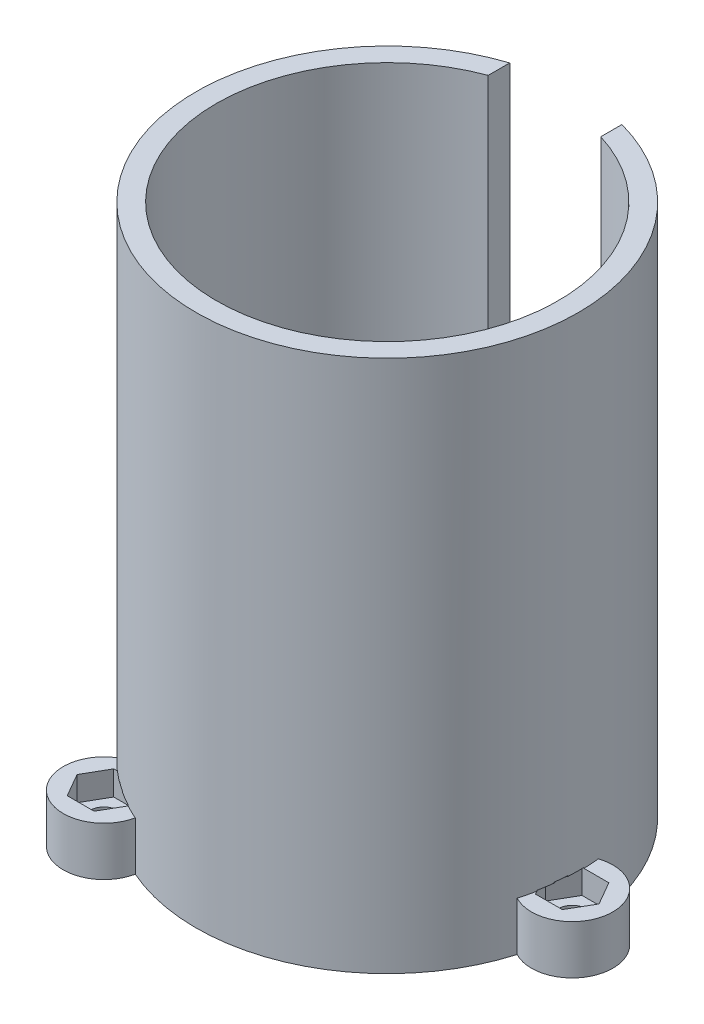
from build123d import *

# Parameters (mm, degrees)
WHEEL_SUPPORT_RAILS_1_PROFILE_R       = 1.7
WHEEL_SUPPORT_RAILS_1_EXTRUSION_DEPTH = 3
WHEEL_SUPPORT_RAILS_2_EXTRUSION_DEPTH = 3
WHEEL_SUPPORT_RAILS_3_EXTRUSION_DEPTH = 0.1
WHEEL_SUPPORT_RAILS_4_EXTRUSION_DEPTH = 0.1
PIVOT_BACKING_5_EXTRUSION_DEPTH       = 59.3


with BuildPart() as part:
    # Wheel support rails 1 profile → Wheel support rails 1 extrusion (new body)
    with BuildSketch(Plane(origin=(0, -200, 0), x_dir=(1, 0, 0), z_dir=(0, 1, 0))):
        with BuildLine():
            Line((-19.3635199, 72.551817663), (-19.796031534, 72.551817663))
            Line((-19.796031534, 72.551817663), (-19.796031534, 77.344882879))
            Line((-19.796031534, 77.344882879), (-18.287181296, 77.344882879))
            ThreePointArc((-18.287181296, 77.344882879), (-19.831302101, 79.707937327), (-22.409182889, 80.858096458))
            Line((-22.409182889, 80.858096458), (-22.409182889, 77.466920099))
            ThreePointArc((-22.409182889, 77.466920099), (-21.643496924, 74.985063993), (-24.218406931, 74.644882879))
            Line((-24.218406931, 74.644882879), (-27.913875328, 74.644882879))
            ThreePointArc((-27.913875328, 74.644882879), (-27.347266001, 73.305528815), (-26.419206918, 72.185876289))
            ThreePointArc((-26.419206918, 72.185876289), (-35.919758288, 55.293042834), (-29.496951386, 37.007096044))
            ThreePointArc((-29.496951386, 37.007096044), (-29.716475974, 28.670321551), (-21.957552332, 31.727951993))
            ThreePointArc((-21.957552332, 31.727951993), (-2.577653733, 31.946649884), (10.047037269, 46.651937219))
            ThreePointArc((10.047037269, 46.651937219), (17.37665806, 50.630210597), (10.849210599, 55.820820355))
            ThreePointArc((10.849210599, 55.820820355), (5.348356993, 68.520951403), (-6.346539744, 75.922445127))
            Line((-6.346539744, 75.922445127), (-6.346539744, 73.320286475))
            ThreePointArc((-6.346539744, 73.320286475), (4.101805551, 66.093036958), (8.470715341, 54.163507116))
            ThreePointArc((8.470715341, 54.163507116), (7.414711079, 51.501768024), (7.992466121, 48.697093513))
            ThreePointArc((7.992466121, 48.697093513), (-3.634199387, 34.212419351), (-22.203580069, 34.616445929))
            ThreePointArc((-22.203580069, 34.616445929), (-23.98071161, 36.861841994), (-26.698508507, 37.763828705))
            ThreePointArc((-26.698508507, 37.763828705), (-33.429271543, 55.075153477), (-23.794683922, 70.954695591))
            ThreePointArc((-23.794683922, 70.954695591), (-21.379253869, 71.198784638), (-19.3635199, 72.551817663))
        make_face()
        with Locations(Location((12.395684569, 51.06598931, 0), (0, 0, 270))):
            Circle(WHEEL_SUPPORT_RAILS_1_PROFILE_R, mode=Mode.SUBTRACT)
        with Locations(Location((-26.848593792, 32.766081772, 0), (0, 0, 270))):
            Circle(WHEEL_SUPPORT_RAILS_1_PROFILE_R, mode=Mode.SUBTRACT)
    extrude(amount=WHEEL_SUPPORT_RAILS_1_EXTRUSION_DEPTH)

    # Wheel support rails 2 profile → Wheel support rails 2 extrusion (add)
    # profile 1 of 2: a face of its own
    with BuildSketch(Plane(origin=(0, -197, 0), x_dir=(1, 0, 0), z_dir=(0, 1, 0))):
        with BuildLine():
            Line((-19.3635199, 72.551817663), (-19.796031533, 72.551817663))
            Line((-19.796031533, 72.551817663), (-19.796031533, 75.86552534))
            Line((-19.796031533, 75.86552534), (-21.424639427, 73.044693722))
            Line((-21.424639427, 73.044693722), (-24.724639427, 73.044693722))
            Line((-24.724639427, 73.044693722), (-25.648509068, 74.644882879))
            Line((-25.648509068, 74.644882879), (-27.913875328, 74.644882879))
            ThreePointArc((-27.913875328, 74.644882879), (-27.347266001, 73.305528815), (-26.419206918, 72.185876289))
            ThreePointArc((-26.419206918, 72.185876289), (-35.919758288, 55.293042834), (-29.496951386, 37.007096044))
            ThreePointArc((-29.496951386, 37.007096044), (-29.716475974, 28.670321551), (-21.957552332, 31.727951993))
            ThreePointArc((-21.957552332, 31.727951993), (-2.577653733, 31.946649884), (10.047037269, 46.651937219))
            ThreePointArc((10.047037269, 46.651937219), (17.37665806, 50.630210597), (10.849210599, 55.820820355))
            ThreePointArc((10.849210599, 55.820820355), (5.348356993, 68.520951403), (-6.346539744, 75.922445127))
            Line((-6.346539744, 75.922445127), (-6.346539744, 73.320286475))
            ThreePointArc((-6.346539744, 73.320286475), (4.101805551, 66.093036958), (8.470715341, 54.163507116))
            ThreePointArc((8.470715341, 54.163507116), (7.414711079, 51.501768024), (7.992466121, 48.697093513))
            ThreePointArc((7.992466121, 48.697093513), (-3.634199387, 34.212419351), (-22.203580069, 34.616445929))
            ThreePointArc((-22.203580069, 34.616445929), (-23.98071161, 36.861841994), (-26.698508507, 37.763828705))
            ThreePointArc((-26.698508507, 37.763828705), (-33.429271543, 55.075153477), (-23.794683922, 70.954695591))
            ThreePointArc((-23.794683922, 70.954695591), (-21.379253869, 71.198784638), (-19.3635199, 72.551817663))
        make_face()
        Polygon((9.095684569, 51.06598931), (10.745684569, 53.923873143), (14.045684569, 53.923873143), (15.695684569, 51.06598931), (14.045684569, 48.208105478), (10.745684569, 48.208105478), align=None, mode=Mode.SUBTRACT)
        Polygon((-30.148593792, 32.766081772), (-28.498593792, 35.623965604), (-25.198593792, 35.623965604), (-23.548593792, 32.766081772), (-25.198593792, 29.908197939), (-28.498593792, 29.908197939), align=None, mode=Mode.SUBTRACT)
    # profile 2 of 2: a face of its own
    with BuildSketch(Plane(origin=(0, -197, 0), x_dir=(1, 0, 0), z_dir=(0, 1, 0))):
        with BuildLine():
            Line((-22.409182889, 78.760461387), (-21.424639427, 78.760461387))
            Line((-21.424639427, 78.760461387), (-19.796031533, 75.939629769))
            Line((-19.796031533, 75.939629769), (-19.796031533, 77.344882879))
            Line((-19.796031533, 77.344882879), (-18.287181296, 77.344882879))
            ThreePointArc((-18.287181296, 77.344882879), (-19.831302101, 79.707937327), (-22.409182889, 80.858096458))
            Line((-22.409182889, 80.858096458), (-22.409182889, 78.760461387))
        make_face()
    extrude(amount=WHEEL_SUPPORT_RAILS_2_EXTRUSION_DEPTH)

    # Wheel support rails 3 profile → Wheel support rails 3 extrusion (add)
    with BuildSketch(Plane(origin=(0, -194, 0), x_dir=(1, 0, 0), z_dir=(0, 1, 0))):
        with BuildLine():
            Line((9.095684569, 51.06598931), (10.745684569, 53.923873143))
            Line((10.745684569, 53.923873143), (10.981005967, 53.923873143))
            ThreePointArc((10.981005967, 53.923873143), (5.95177331, 67.785965934), (-6.346539744, 75.922445127))
            Line((-6.346539744, 75.922445127), (-6.346539744, 73.320286475))
            ThreePointArc((-6.346539744, 73.320286475), (-11.915808048, 32.253267736), (-19.796031533, 72.940106583))
            Line((-19.796031533, 72.940106583), (-19.796031533, 75.586589097))
            ThreePointArc((-19.796031533, 75.586589097), (-19.895657477, 75.553849531), (-19.99513633, 75.520665715))
            Line((-19.99513633, 75.520665715), (-21.424639427, 73.044693721))
            Line((-21.424639427, 73.044693721), (-24.724639427, 73.044693721))
            Line((-24.724639427, 73.044693721), (-24.842300126, 73.24848803))
            ThreePointArc((-24.842300126, 73.24848803), (-35.923839859, 55.245842318), (-28.057599985, 35.623965605))
            Line((-28.057599985, 35.623965605), (-25.198593791, 35.623965605))
            Line((-25.198593791, 35.623965605), (-23.548593792, 32.766081772))
            Line((-23.548593792, 32.766081772), (-23.666254491, 32.562287463))
            ThreePointArc((-23.666254491, 32.562287463), (-2.534736101, 31.966715397), (10.525187666, 48.590017317))
            Line((10.525187666, 48.590017317), (9.095684569, 51.06598931))
        make_face()
    extrude(amount=WHEEL_SUPPORT_RAILS_3_EXTRUSION_DEPTH)

    # Wheel support rails 4 profile → Wheel support rails 4 extrusion (add)
    with BuildSketch(Plane(origin=(0, -193.9, 0), x_dir=(1, 0, 0), z_dir=(0, 1, 0))):
        with BuildLine():
            Line((-6.346539744, 75.922445127), (-6.346539744, 73.320286475))
            ThreePointArc((-6.346539744, 73.320286475), (-11.915808048, 32.253267736), (-19.796031533, 72.940106583))
            Line((-19.796031533, 72.940106583), (-19.796031533, 75.586589097))
            ThreePointArc((-19.796031533, 75.586589097), (-20.77224205, 75.244243169), (-21.732439848, 74.859265381))
            ThreePointArc((-21.732439848, 74.859265381), (-22.356188381, 74.361854317), (-23.138165192, 74.203764887))
            ThreePointArc((-23.138165192, 74.203764887), (-35.919758287, 55.293042834), (-26.616158734, 34.450116791))
            ThreePointArc((-26.616158734, 34.450116791), (-25.873513849, 34.158640248), (-25.345615983, 33.560473178))
            ThreePointArc((-25.345615983, 33.560473178), (-2.577653732, 31.946649884), (10.821049933, 50.425266465))
            ThreePointArc((10.821049933, 50.425266465), (10.702153582, 51.214154072), (10.956232526, 51.97041057))
            ThreePointArc((10.956232526, 51.97041057), (6.540238452, 67.006043687), (-6.346539744, 75.922445127))
        make_face()
    extrude(amount=WHEEL_SUPPORT_RAILS_4_EXTRUSION_DEPTH)

    # Pivot backing 5 profile → Pivot backing 5 extrusion (add)
    with BuildSketch(Plane(origin=(0, -193.8, 0), x_dir=(1, 0, 0), z_dir=(0, 1, 0))):
        with BuildLine():
            Line((-6.346539744, 75.922445127), (-6.346539744, 73.320286475))
            ThreePointArc((-6.346539744, 73.320286475), (-11.915808048, 32.253267736), (-19.796031533, 72.940106583))
            Line((-19.796031533, 72.940106583), (-19.796031533, 75.586589097))
            ThreePointArc((-19.796031533, 75.586589097), (-11.922531942, 29.752206559), (-6.346539744, 75.922445127))
        make_face()
    extrude(amount=PIVOT_BACKING_5_EXTRUSION_DEPTH)


solid = part.part
